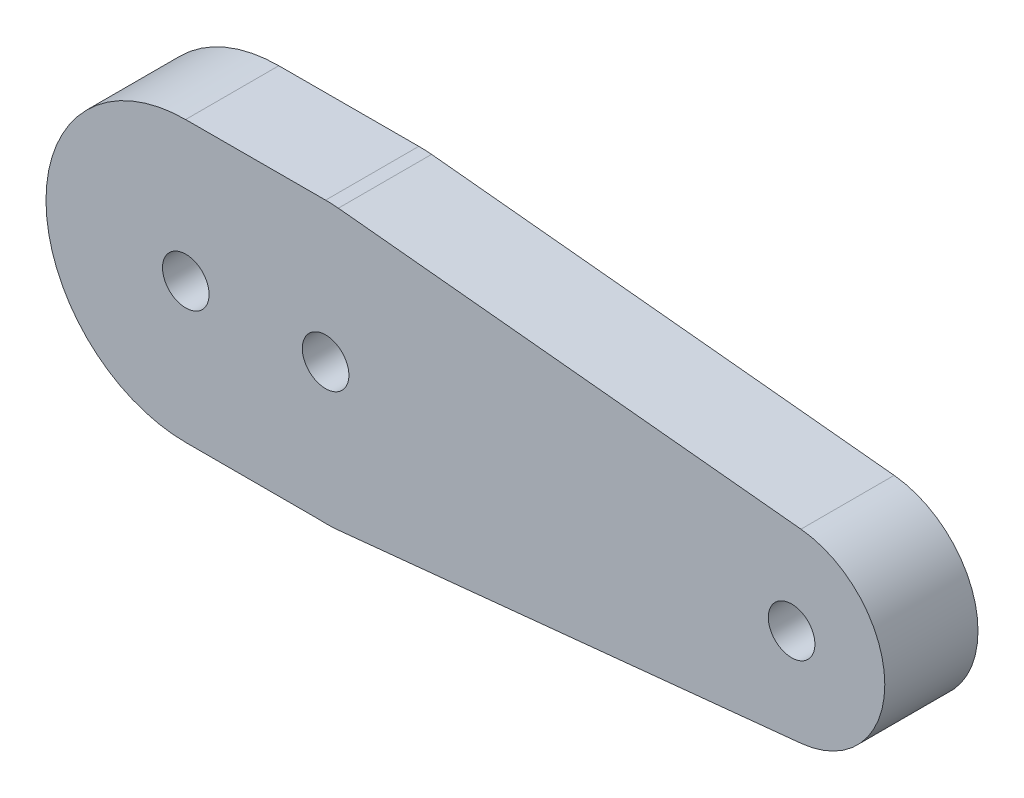
from build123d import *

# Parameters (mm, degrees)
SKETCH1_R           = 2.5
BOSS_EXTRUDE1_DEPTH = 5


with BuildPart() as part:
    # Sketch1 → Boss-Extrude1 (new, symmetric)
    with BuildSketch(Plane.XY):
        with BuildLine():
            Line((1.370602209, 14.9582984), (51.004064798, 9.949465005))
            ThreePointArc((51.004064798, 9.949465005), (60, 0), (51.004064798, -9.949465005))
            Line((51.004064798, -9.949465005), (1.370602209, -14.9582984))
            ThreePointArc((1.370602209, -14.9582984), (0.289429434, -15.018171395), (-0.793247409, -15))
            Line((-0.793247409, -15), (-15, -15))
            ThreePointArc((-15, -15), (-29.999996344, -0.010472716), (-15.020945427, 14.999985376))
            Line((-15.020945427, 14.999985376), (0, 15.020960071))
            ThreePointArc((0, 15.020960071), (0.686016928, 15.005286476), (1.370602209, 14.9582984))
        make_face()
        with Locations((-15, 0)):
            Circle(SKETCH1_R, mode=Mode.SUBTRACT)
        Circle(SKETCH1_R, mode=Mode.SUBTRACT)
        with Locations((50, 0)):
            Circle(SKETCH1_R, mode=Mode.SUBTRACT)
    extrude(amount=BOSS_EXTRUDE1_DEPTH, both=True)


solid = part.part
